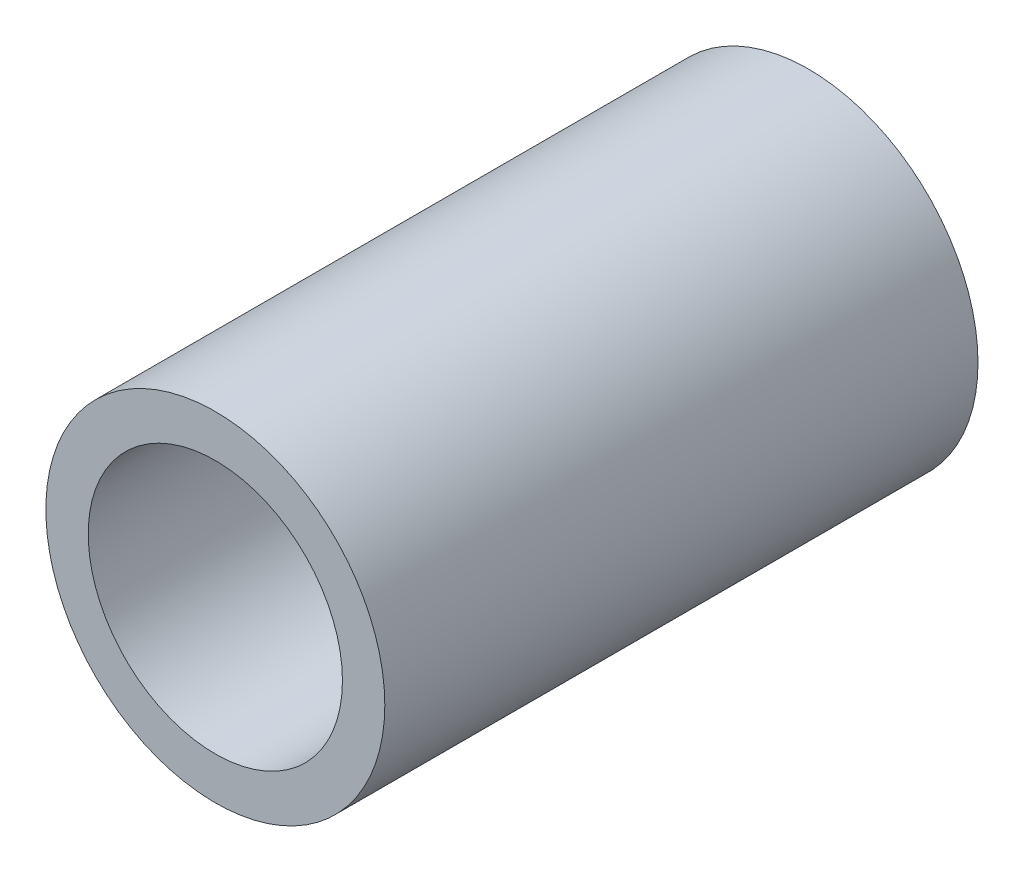
from build123d import *

# Parameters (mm, degrees)
SKETCH1_R           = 6.35
SKETCH1_R_2         = 4.7625
BOSS_EXTRUDE1_DEPTH = 22.225


with BuildPart() as part:
    # Sketch1 → Boss-Extrude1 (new body)
    with BuildSketch(Plane.XY):
        Circle(SKETCH1_R)
        Circle(SKETCH1_R_2, mode=Mode.SUBTRACT)
    extrude(amount=BOSS_EXTRUDE1_DEPTH)


solid = part.part
